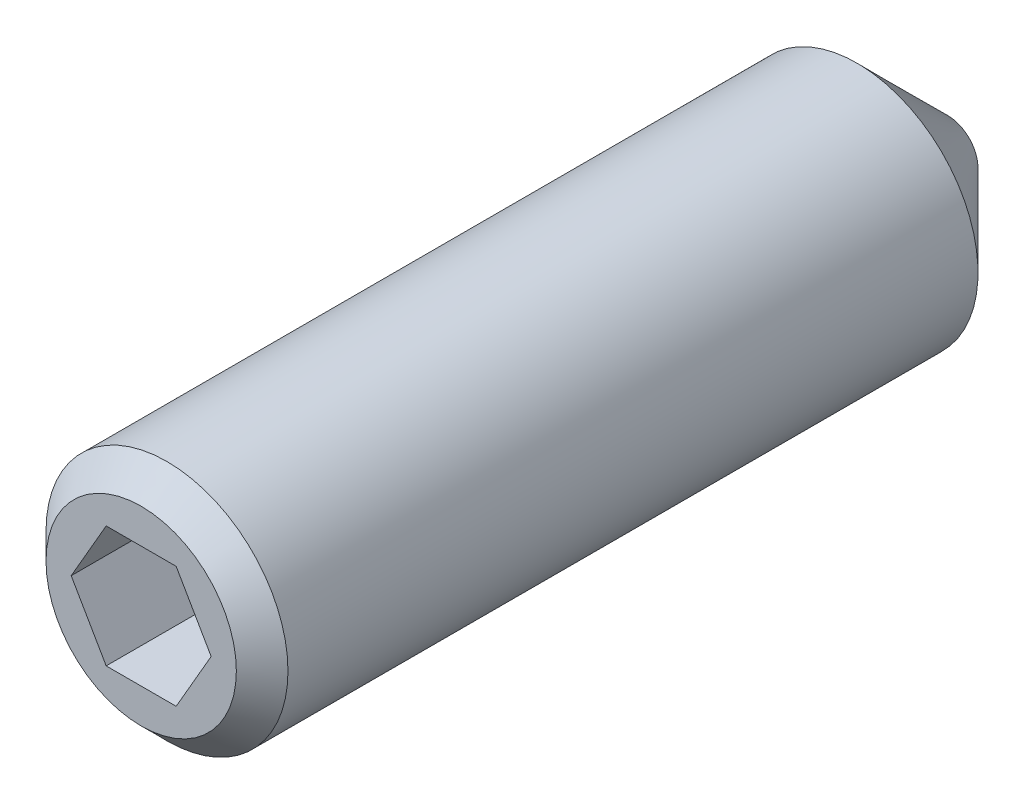
from build123d import *

# Parameters (mm, degrees)
SKETCH1_R           = 1.5
BOSS_EXTRUDE1_DEPTH = 10
CUT_EXTRUDE1_DEPTH  = 1.2
SKETCH3_OUTSIDE_W   = 9.572
SKETCH3_OUTSIDE_H   = 9.572
SKETCH3_OUTSIDE_R   = 1.18
CUT_EXTRUDE2_DEPTH  = 1.2
CUT_EXTRUDE2_DRAFT  = -45
SKETCH4_OUTSIDE_W   = 9.572
SKETCH4_OUTSIDE_H   = 9.572
SKETCH4_OUTSIDE_R   = 0.375
CUT_EXTRUDE3_DEPTH  = 1.2
CUT_EXTRUDE3_DRAFT  = -45


with BuildPart() as part:
    # Sketch1 → Boss-Extrude1 (new body)
    with BuildSketch(Plane.XY):
        Circle(SKETCH1_R)
    extrude(amount=BOSS_EXTRUDE1_DEPTH)

    # Sketch2 → Cut-Extrude1 (cut)
    with BuildSketch(Plane.XY.offset(10)):
        Polygon((0.867651504, 0), (0.433825752, 0.751408244), (-0.433825752, 0.751408244), (-0.867651504, 0), (-0.433825752, -0.751408244), (0.433825752, -0.751408244), align=None)
    extrude(amount=-CUT_EXTRUDE1_DEPTH, mode=Mode.SUBTRACT)


with BuildPart() as cut_extrude2_tool:
    # Sketch3 outside → Cut-Extrude2 (with draft: the straight prism first)
    with BuildSketch(Plane.XY.offset(10)):
        Rectangle(SKETCH3_OUTSIDE_W, SKETCH3_OUTSIDE_H)
        Circle(SKETCH3_OUTSIDE_R, mode=Mode.SUBTRACT)
    extrude(amount=-CUT_EXTRUDE2_DEPTH)
    # Cut-Extrude2: the draft: its side faces are tilted about the plane it starts from
    cut_extrude2_sides = [cut_extrude2_tool.faces().sort_by_distance(p)[0] for p in [
        (0, -4.786, 9.4),
        (4.786, 0, 9.4),
        (0, 4.786, 9.4),
        (-4.786, 0, 9.4),
        (-1.18, 0, 9.4),
    ]]
    draft(cut_extrude2_sides, Plane.XY.offset(10), CUT_EXTRUDE2_DRAFT)


with BuildPart() as part_1:
    add(part.part)

    # Cut-Extrude2: cut by cut_extrude2_tool
    add(cut_extrude2_tool.part, mode=Mode.SUBTRACT)


with BuildPart() as cut_extrude3_tool:
    # Sketch4 outside → Cut-Extrude3 (with draft: the straight prism first)
    with BuildSketch(Plane(origin=(0, 0, 0), x_dir=(-1, 0, 0), z_dir=(0, 0, -1))):
        Rectangle(SKETCH4_OUTSIDE_W, SKETCH4_OUTSIDE_H)
        Circle(SKETCH4_OUTSIDE_R, mode=Mode.SUBTRACT)
    extrude(amount=-CUT_EXTRUDE3_DEPTH)
    # Cut-Extrude3: the draft: its side faces are tilted about the plane it starts from
    cut_extrude3_sides = [cut_extrude3_tool.faces().sort_by_distance(p)[0] for p in [
        (0, -4.786, 0.6),
        (-4.786, 0, 0.6),
        (0, 4.786, 0.6),
        (4.786, 0, 0.6),
        (0.375, 0, 0.6),
    ]]
    draft(cut_extrude3_sides, Plane(origin=(0, 0, 0), x_dir=(-1, 0, 0), z_dir=(0, 0, -1)), CUT_EXTRUDE3_DRAFT)


with BuildPart() as part_2:
    add(part_1.part)

    # Cut-Extrude3: cut by cut_extrude3_tool
    add(cut_extrude3_tool.part, mode=Mode.SUBTRACT)


solid = part_2.part
